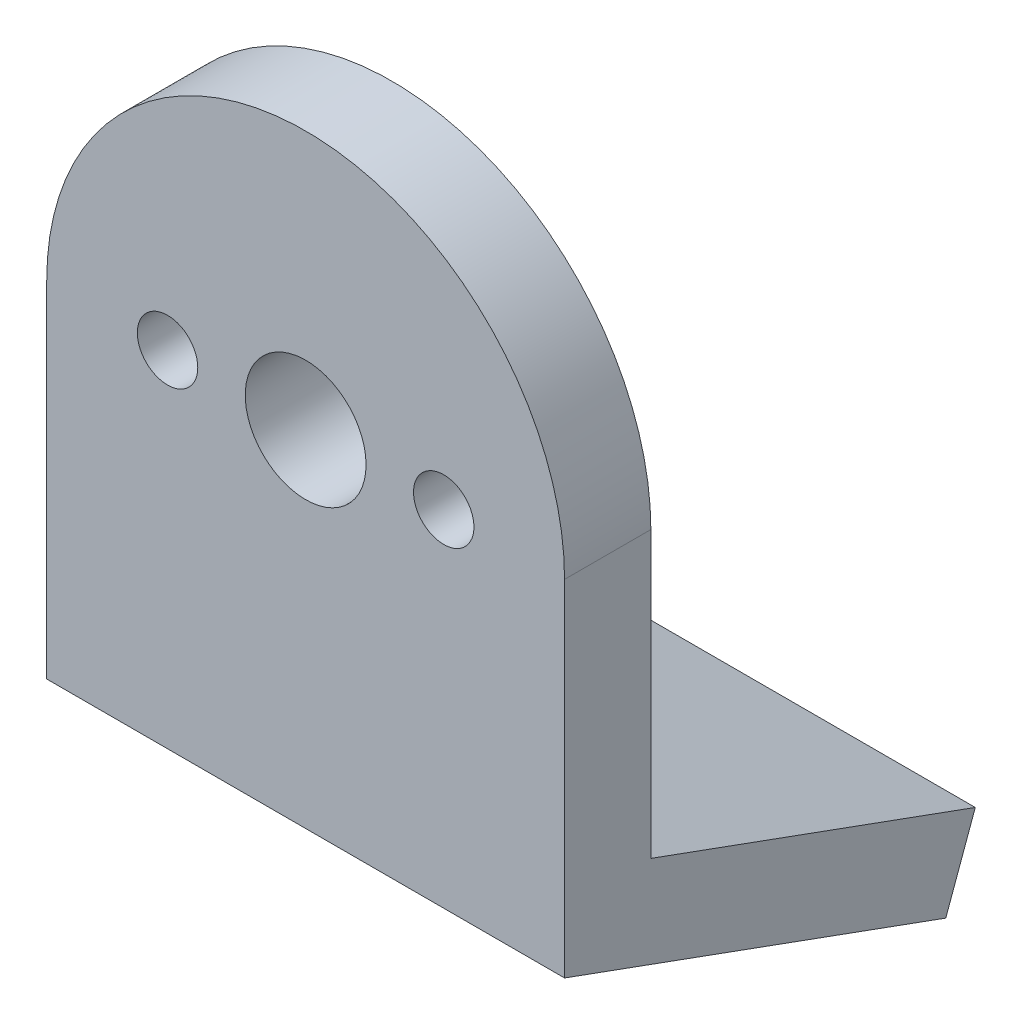
from build123d import *

# Parameters (mm, degrees)
ESQUISSE1_R             = 1.75
ESQUISSE1_R_2           = 3.5
BOSS_EXTRU_1_DEPTH      = 5
ENL_V_MAT_EXTRU_2_REACH = 41.592
BOSS_EXTRU_2_DEPTH      = 30
ESQUISSE5_W             = 30
ESQUISSE5_H             = 5
BOSS_EXTRU_3_DEPTH      = 20


with BuildPart() as part:
    # Esquisse1 → Boss.-Extru.1 (new body)
    with BuildSketch(Plane.XY):
        with BuildLine():
            Line((-15.959557324, 10.348837209), (-15.959557324, -9.651162791))
            Line((-15.959557324, -9.651162791), (14.040442676, -9.651162791))
            Line((14.040442676, -9.651162791), (14.040442676, 10.348837209))
            ThreePointArc((14.040442676, 10.348837209), (-0.959557324, 25.348837209), (-15.959557324, 10.348837209))
        make_face()
        with Locations((-8.959557324, 10.348837209)):
            Circle(ESQUISSE1_R, mode=Mode.SUBTRACT)
        with Locations((7.040442676, 10.348837209)):
            Circle(ESQUISSE1_R, mode=Mode.SUBTRACT)
        with Locations((-0.959557324, 10.348837209)):
            Circle(ESQUISSE1_R_2, mode=Mode.SUBTRACT)
    extrude(amount=BOSS_EXTRU_1_DEPTH)

    # Esquisse2 → Enlèv. mat.-Extru.2 (cut, up to next)
    with BuildSketch(Plane.ZY.offset(15.959557324), mode=Mode.PRIVATE) as enl_v_mat_extru_2_sk1:
        Polygon((0, -9.651162791), (0, -6.1501251), (1.274273509, -9.651162791), align=None)
    enl_v_mat_extru_2_tool1 = extrude(enl_v_mat_extru_2_sk1.sketch, amount=-ENL_V_MAT_EXTRU_2_REACH, mode=Mode.PRIVATE) & part.part
    add(enl_v_mat_extru_2_tool1.solids().sort_by_distance((-15.959557, -8.48415, 0.424758))[0], mode=Mode.SUBTRACT)

    # Esquisse4 → Boss.-Extru.2 (add)
    with BuildSketch(Plane.ZY.offset(15.959557324)):
        Polygon((5, -9.651162791), (1.710100717, -10.848588204), (1.274273509, -9.651162791), align=None)
    extrude(amount=-BOSS_EXTRU_2_DEPTH)

    # Esquisse5 → Boss.-Extru.3 (add)
    with BuildSketch(Plane(origin=(0, -0.719427971, -1.976612106), x_dir=(-1, 0, 0), z_dir=(0, -0.34202014332566333, -0.9396926207859103))):
        with Locations((0.959557324, -8.279227173)):
            Rectangle(ESQUISSE5_W, ESQUISSE5_H)
    extrude(amount=BOSS_EXTRU_3_DEPTH)


solid = part.part
